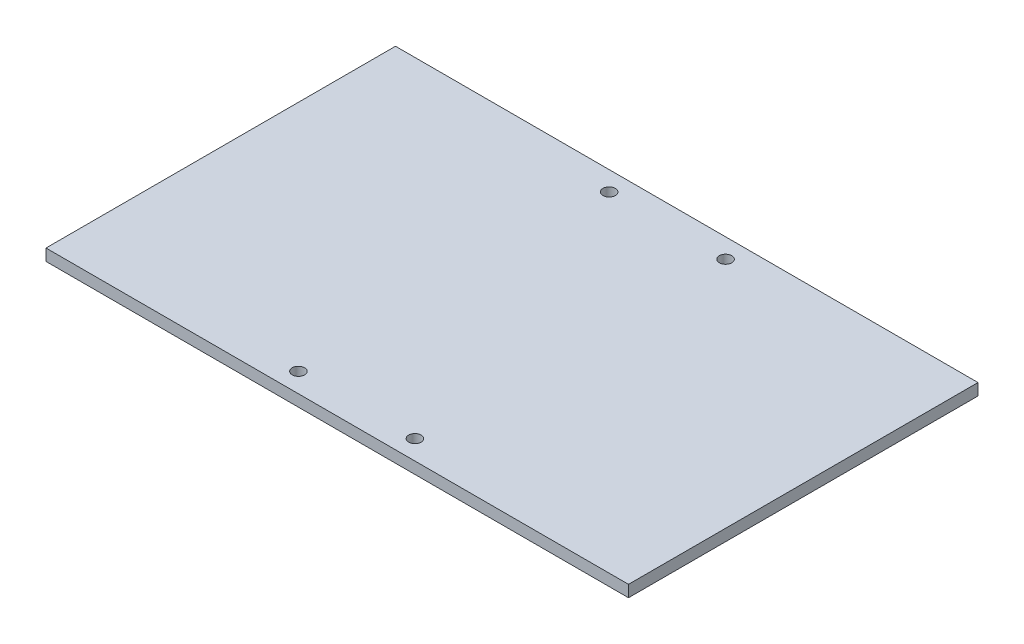
from build123d import *

# Parameters (mm, degrees)
SKETCH1_W           = 150
SKETCH1_H           = 90
SKETCH1_R           = 1.6
BOSS_EXTRUDE1_DEPTH = 3


with BuildPart() as part:
    # Sketch1 → Boss-Extrude1 (new body)
    with BuildSketch(Plane(origin=(0, 0, 0), x_dir=(1, 0, 0), z_dir=(0, 1, 0))):
        Rectangle(SKETCH1_W, SKETCH1_H)
        with Locations((15, -40)):
            Circle(SKETCH1_R, mode=Mode.SUBTRACT)
        with Locations((-15, 40)):
            Circle(SKETCH1_R, mode=Mode.SUBTRACT)
        with Locations((-15, -40)):
            Circle(SKETCH1_R, mode=Mode.SUBTRACT)
        with Locations((15, 40)):
            Circle(SKETCH1_R, mode=Mode.SUBTRACT)
    extrude(amount=BOSS_EXTRUDE1_DEPTH)


solid = part.part
